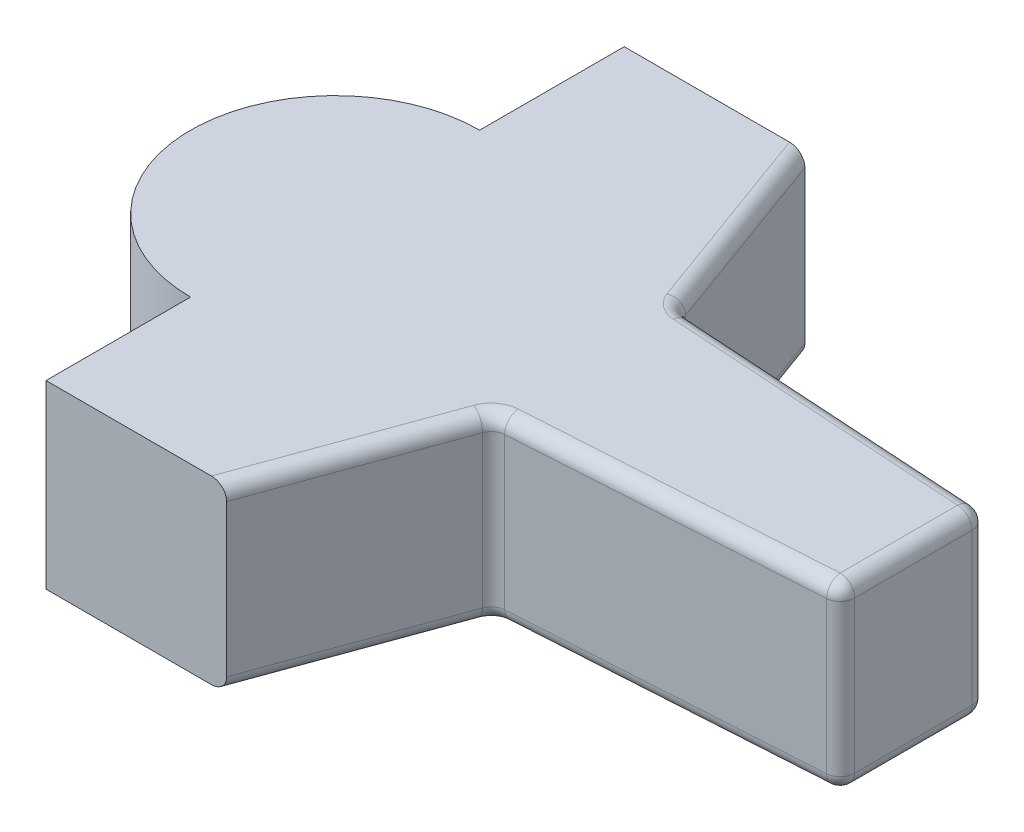
from build123d import *

# Parameters (mm, degrees)
SKETCH1_R           = 10
BOSS_EXTRUDE1_DEPTH = 6.25
BOSS_EXTRUDE2_DEPTH = 6.25
BOSS_EXTRUDE5_DEPTH = 12.5
FILLET2_R           = 1
FILLET3_R           = 1


with BuildPart() as part:
    # Sketch1 → Boss-Extrude1 (new, symmetric)
    with BuildSketch(Plane(origin=(0, 0, 0), x_dir=(-1, 0, 0), z_dir=(0, 1, 0))):
        with Locations(Location((0, 0, 0), (0, 0, 90))):
            Circle(SKETCH1_R)
    extrude(amount=BOSS_EXTRUDE1_DEPTH, both=True)

    # Sketch2 → Boss-Extrude2 (add, symmetric)
    with BuildSketch(Plane(origin=(0, 0, 0), x_dir=(-1, 0, 0), z_dir=(0, 1, 0))):
        Polygon((0, 0), (0, 7.5), (-40, 5), (-40, -5), (0, -7.5), align=None)
    extrude(amount=BOSS_EXTRUDE2_DEPTH, both=True)

    # Sketch4 → Boss-Extrude5 (add, through all)
    with BuildSketch(Plane(origin=(0, 6.25, 0), x_dir=(1, 0, 0), z_dir=(0, 1, 0))):
        Polygon((19.779404685, 0), (12.5, -20), (0, -20), (0, 20), (12.5, 20), align=None)
    extrude(amount=-BOSS_EXTRUDE5_DEPTH)

    # Fillet2
    fillet2_edges = [part.edges().sort_by_distance(p)[0] for p in [
        (40, 0, -5),
        (40, 0, 5),
        (17.446503424, 0, -6.409593536),
        (17.446503424, 0, 6.409593536),
    ]]
    fillet(fillet2_edges, radius=FILLET2_R)

    # Fillet3
    fillet3_edges = [part.edges().sort_by_distance(p)[0] for p in [
        (14.86129541, -6.25, 13.512394182),
        (14.86129541, 6.25, 13.512394182),
        (28.58114172, 6.25, 5.713678643),
        (28.58114172, -6.25, 5.713678643),
        (28.58114172, -6.25, -5.713678643),
        (28.58114172, 6.25, -5.713678643),
        (14.86129541, -6.25, -13.512394182),
        (14.86129541, 6.25, -13.512394182),
        (40, -6.25, 0),
        (39.728827238, -6.25, 4.745246418),
        (39.728827238, -6.25, -4.745246418),
        (40, 6.25, 0),
        (39.728827238, 6.25, 4.745246418),
        (39.728827238, 6.25, -4.745246418),
        (17.563425222, -6.25, 6.565953441),
        (17.563425222, 6.25, 6.565953441),
        (17.563425222, 6.25, -6.565953441),
        (17.563425222, -6.25, -6.565953441),
    ]]
    fillet(fillet3_edges, radius=FILLET3_R)


solid = part.part
